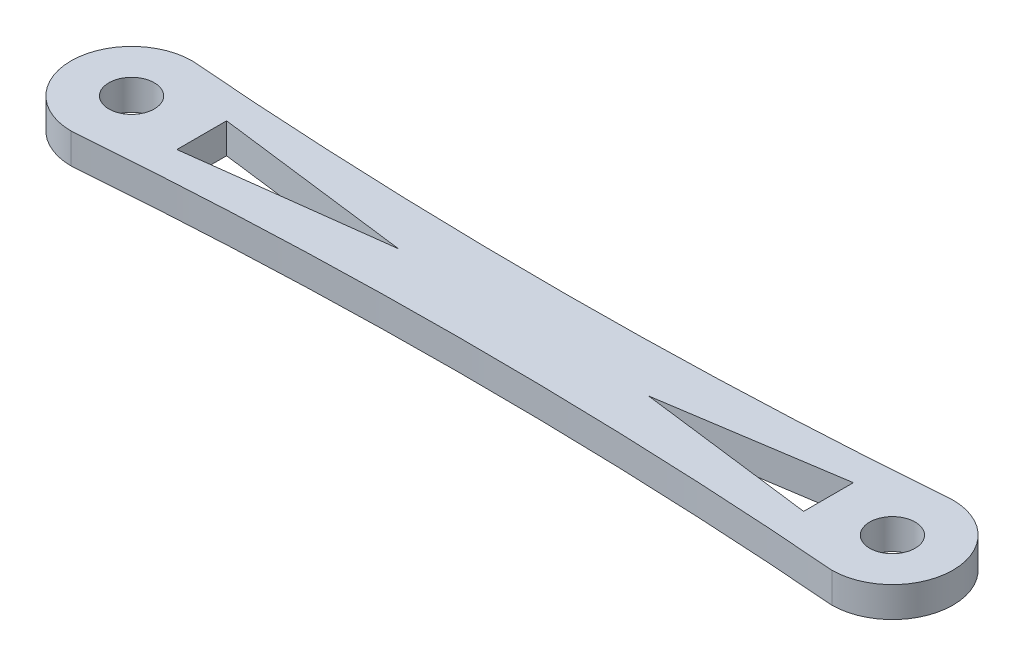
from build123d import *

# Parameters (mm, degrees)
EXTRUDE_1_DEPTH     = 10
SKETCH_2_R          = 7.5
CUT_EXTRUDE_1_DEPTH = 275.118587593
SKETCH_3_R          = 7.5
CUT_EXTRUDE_2_DEPTH = 275.118587593
CUT_EXTRUDE_3_DEPTH = 275.118587593


with BuildPart() as part:
    # 草图1 → 凸台-拉伸1 (new body)
    with BuildSketch(Plane(origin=(0, 0, 0), x_dir=(1, 0, 0), z_dir=(0, 1, 0))):
        with BuildLine():
            ThreePointArc((0, 0), (-20, -20), (0, -40))
            add(Edge.make_bspline(
                [(0, -40), (125.5, -30), (251, -40)],
                knots=[0, 0, 0, 1, 1, 1], degree=2))
            ThreePointArc((251, -40), (271, -20), (251, 0))
            add(Edge.make_bspline(
                [(0, 0), (125.5, -10), (251, 0)],
                knots=[0, 0, 0, 1, 1, 1], degree=2))
        make_face()
    extrude(amount=EXTRUDE_1_DEPTH)

    # 草图2 → 切除-拉伸1 (cut, through all)
    with BuildSketch(Plane(origin=(0, 10, 0), x_dir=(1, 0, 0), z_dir=(0, 1, 0))):
        with Locations(Location((0, -20, 0), (0, 0, 270))):
            Circle(SKETCH_2_R)
    extrude(amount=-CUT_EXTRUDE_1_DEPTH, mode=Mode.SUBTRACT)

    # 草图3 → 切除-拉伸2 (cut, through all)
    with BuildSketch(Plane(origin=(0, 10, 0), x_dir=(1, 0, 0), z_dir=(0, 1, 0))):
        with Locations(Location((251, -20, 0), (0, 0, 270))):
            Circle(SKETCH_3_R)
    extrude(amount=-CUT_EXTRUDE_2_DEPTH, mode=Mode.SUBTRACT)

    # 草图4 → 切除-拉伸3 (cut, through all)
    with BuildSketch(Plane(origin=(0, 10, 0), x_dir=(1, 0, 0), z_dir=(0, 1, 0))):
        Polygon((22.799917897, -11.455899991), (22.799917897, -27.860572008), (87.735077962, -19.658236), align=None)
        Polygon((229.567138104, -11.455899991), (229.567138104, -27.860572008), (170.98456159, -20.460667606), align=None)
    extrude(amount=-CUT_EXTRUDE_3_DEPTH, mode=Mode.SUBTRACT)


solid = part.part
